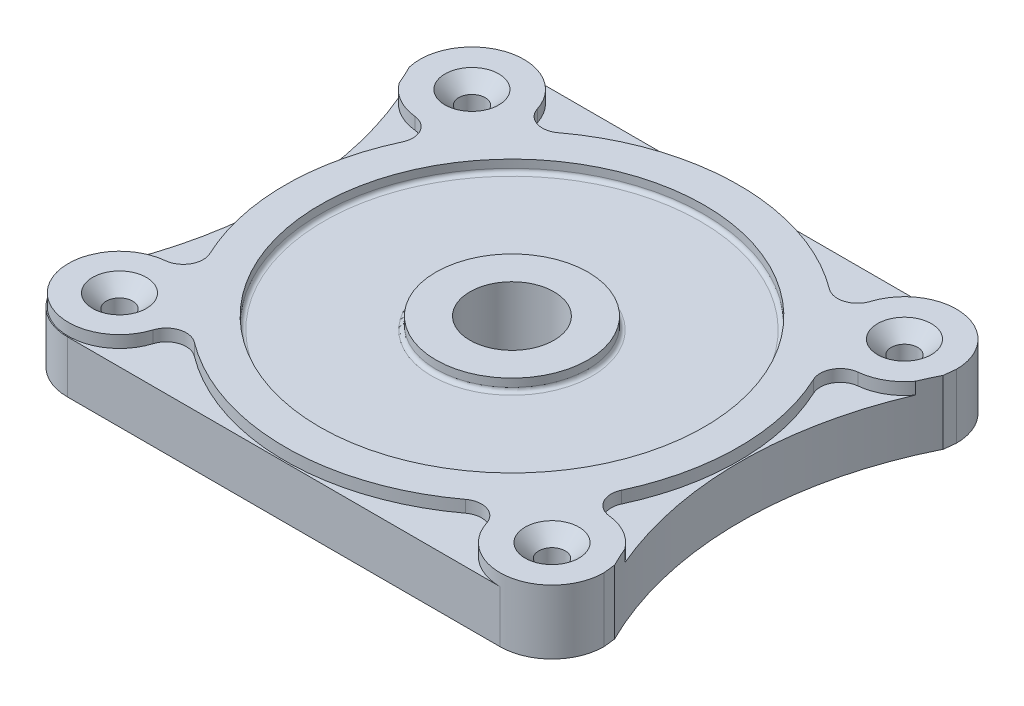
from build123d import *

# Parameters (mm, degrees)
SKETCH1_W                                            = 134
SKETCH1_H                                            = 114
BOSS_EXTRUDE1_DEPTH                                  = 16
SKETCH2_R                                            = 10.5
CUT_EXTRUDE1_DEPTH                                   = 90.409171789
SKETCH3_R                                            = 48
SKETCH3_R_2                                          = 19
CUT_EXTRUDE2_DEPTH                                   = 3
CUT_EXTRUDE3_START                                   = -3
SKETCH5_R                                            = 48
SKETCH5_R_2                                          = 19
CUT_EXTRUDE3_DEPTH                                   = 3
CSK_FOR_M6_HEX_SOCKET_COUNTERSUNK_CAP_SC_D           = 6.6
CSK_FOR_M6_HEX_SOCKET_COUNTERSUNK_CAP_SC_CSINK_D     = 13.44
CSK_FOR_M6_HEX_SOCKET_COUNTERSUNK_CAP_SC_CSINK_ANGLE = 90
SKETCH10_R                                           = 92
CUT_EXTRUDE4_DEPTH                                   = 90.409171789
CUT_EXTRUDE5_DEPTH                                   = 90.409171789
SKETCH13_OUTSIDE_W                                   = 171.332
SKETCH13_OUTSIDE_H                                   = 151.332
CUT_EXTRUDE6_DEPTH                                   = 3
CUT_EXTRUDE7_DEPTH                                   = 90.409171789
CUT_EXTRUDE9_DEPTH                                   = 89.921313531
CUT_EXTRUDE10_DEPTH                                  = 90.409171789
FILLET13_R                                           = 1
FILLET14_R                                           = 1
FILLET16_R                                           = 1
FILLET18_R                                           = 1


with BuildPart() as part:
    # Sketch1 → Boss-Extrude1 (new body)
    with BuildSketch(Plane(origin=(0, 0, 0), x_dir=(1, 0, 0), z_dir=(0, 1, 0))):
        Rectangle(SKETCH1_W, SKETCH1_H)
    extrude(amount=BOSS_EXTRUDE1_DEPTH)

    # Sketch2 → Cut-Extrude1 (cut, through all)
    with BuildSketch(Plane(origin=(0, 16, 0), x_dir=(1, 0, 0), z_dir=(0, 1, 0))):
        with Locations(Location((0, 0, 0), (0, 0, 270))):
            Circle(SKETCH2_R)
    extrude(amount=-CUT_EXTRUDE1_DEPTH, mode=Mode.SUBTRACT)

    # Sketch3 → Cut-Extrude2 (cut)
    with BuildSketch(Plane(origin=(0, 16, 0), x_dir=(1, 0, 0), z_dir=(0, 1, 0))):
        with Locations(Location((0, 0, 0), (0, 0, 270))):
            Circle(SKETCH3_R)
        with Locations(Location((0, 0, 0), (0, 0, 270))):
            Circle(SKETCH3_R_2, mode=Mode.SUBTRACT)
    extrude(amount=-CUT_EXTRUDE2_DEPTH, mode=Mode.SUBTRACT)

    # Sketch5 → Cut-Extrude3 (cut)
    with BuildSketch(Plane.XZ.offset(CUT_EXTRUDE3_START)):
        with Locations(Location((0, 0, 0), (0, 0, 90))):
            Circle(SKETCH5_R)
        with Locations(Location((0, 0, 0), (0, 0, 90))):
            Circle(SKETCH5_R_2, mode=Mode.SUBTRACT)
    extrude(amount=CUT_EXTRUDE3_DEPTH, mode=Mode.SUBTRACT)

    # CSK for M6 Hex Socket Countersunk Cap Screw1 (through all)
    with Locations(Plane(origin=(0, 16, 0), x_dir=(1, 0, 0), z_dir=(0, 1, 0))):
        with Locations((-54, 44), (54, 44), (54, -44), (-54, -44)):
            CounterSinkHole(CSK_FOR_M6_HEX_SOCKET_COUNTERSUNK_CAP_SC_D / 2, CSK_FOR_M6_HEX_SOCKET_COUNTERSUNK_CAP_SC_CSINK_D / 2, counter_sink_angle=CSK_FOR_M6_HEX_SOCKET_COUNTERSUNK_CAP_SC_CSINK_ANGLE)

    # Sketch10 → Cut-Extrude4 (cut, through all)
    with BuildSketch(Plane(origin=(0, 16, 0), x_dir=(1, 0, 0), z_dir=(0, 1, 0))):
        with Locations((149, 0)):
            Circle(SKETCH10_R)
        with Locations((-149, 0)):
            Circle(SKETCH10_R)
    extrude(amount=-CUT_EXTRUDE4_DEPTH, mode=Mode.SUBTRACT)

    # Sketch12 → Cut-Extrude5 (cut, through all)
    with BuildSketch(Plane(origin=(0, 16, 0), x_dir=(1, 0, 0), z_dir=(0, 1, 0))):
        with BuildLine():
            ThreePointArc((-54, -57), (-63.192388155, -53.192388155), (-67, -44))
            Line((-67, -44), (-67, -57))
            Line((-67, -57), (-54, -57))
        make_face()
        with BuildLine():
            ThreePointArc((67, -44), (63.192388155, -53.192388155), (54, -57))
            Line((54, -57), (67, -57))
            Line((67, -57), (67, -44))
        make_face()
        with BuildLine():
            Line((-67, 57), (-67, 44))
            ThreePointArc((-67, 44), (-63.192388155, 53.192388155), (-54, 57))
            Line((-54, 57), (-67, 57))
        make_face()
        with BuildLine():
            Line((67, 57), (54, 57))
            ThreePointArc((54, 57), (63.192388155, 53.192388155), (67, 44))
            Line((67, 44), (67, 57))
        make_face()
    extrude(amount=-CUT_EXTRUDE5_DEPTH, mode=Mode.SUBTRACT)

    # Sketch13 outside → Cut-Extrude6 (cut)
    with BuildSketch(Plane(origin=(0, 16, 0), x_dir=(1, 0, 0), z_dir=(0, 1, 0))):
        Rectangle(SKETCH13_OUTSIDE_W, SKETCH13_OUTSIDE_H)
        with BuildLine():
            ThreePointArc((-51.331145195, 23.980195102), (-56.656176853, -0.117680258), (-51.231084425, -24.193226589))
            ThreePointArc((-51.231084425, -24.193226589), (-51.401784959, -28.792660763), (-55.258927529, -31.303912362))
            ThreePointArc((-55.258927529, -31.303912362), (-63.890720648, -52.059105714), (-41.819855837, -47.797318529))
            ThreePointArc((-41.819855837, -47.797318529), (-38.581301156, -44.526890885), (-34.042183736, -45.288695617))
            ThreePointArc((-34.042183736, -45.288695617), (-0.117680258, -56.656176853), (33.853752972, -45.429721922))
            ThreePointArc((33.853752972, -45.429721922), (38.374825497, -44.679906606), (41.60767448, -47.928138008))
            ThreePointArc((41.60767448, -47.928138008), (64.078054812, -52.211748365), (55.344194725, -31.069681344))
            ThreePointArc((55.344194725, -31.069681344), (51.509943359, -28.559534684), (51.331145195, -23.980195102))
            ThreePointArc((51.331145195, -23.980195102), (56.656299069, 0), (51.331145195, 23.980195102))
            ThreePointArc((51.331145195, 23.980195102), (51.509943359, 28.559534684), (55.344194725, 31.069681344))
            ThreePointArc((55.344194725, 31.069681344), (64.078054812, 52.211748365), (41.60767448, 47.928138008))
            ThreePointArc((41.60767448, 47.928138008), (38.374825497, 44.679906606), (33.853752972, 45.429721922))
            ThreePointArc((33.853752972, 45.429721922), (0, 56.656299069), (-33.853752972, 45.429721922))
            ThreePointArc((-33.853752972, 45.429721922), (-38.374825497, 44.679906606), (-41.60767448, 47.928138008))
            ThreePointArc((-41.60767448, 47.928138008), (-64.078054812, 52.211748365), (-55.344194725, 31.069681344))
            ThreePointArc((-55.344194725, 31.069681344), (-51.509943359, 28.559534684), (-51.331145195, 23.980195102))
        make_face(mode=Mode.SUBTRACT)
    extrude(amount=-CUT_EXTRUDE6_DEPTH, mode=Mode.SUBTRACT)

    # Sketch14 → Cut-Extrude7 (cut, through all)
    with BuildSketch(Plane(origin=(0, 16, 0), x_dir=(1, 0, 0), z_dir=(0, 1, 0))):
        Polygon((67, 44), (66.656381451, 41.030823587), (67, 41.713307229), align=None)
    extrude(amount=-CUT_EXTRUDE7_DEPTH, mode=Mode.SUBTRACT)

    # Sketch15 → Cut-Extrude9 (cut, through all)
    with BuildSketch(Plane(origin=(0, 13, 0), x_dir=(1, 0, 0), z_dir=(0, 1, 0))):
        Polygon((67, -41.713307229), (66.656381451, -41.030823587), (67, -44), align=None)
    extrude(amount=-CUT_EXTRUDE9_DEPTH, mode=Mode.SUBTRACT)

    # Sketch16 → Cut-Extrude10 (cut, through all)
    with BuildSketch(Plane(origin=(0, 16, 0), x_dir=(1, 0, 0), z_dir=(0, 1, 0))):
        Polygon((66.656381451, -41.030823587), (67, -44), (67.112484147, -42.334698628), align=None)
    extrude(amount=-CUT_EXTRUDE10_DEPTH, mode=Mode.SUBTRACT)

    # Fillet13
    fillet13_edges = [part.edges().sort_by_distance(p)[0] for p in [
        (0, 13, -19),
    ]]
    fillet(fillet13_edges, radius=FILLET13_R)

    # Fillet14
    fillet14_edges = [part.edges().sort_by_distance(p)[0] for p in [
        (0, 13, -48),
    ]]
    fillet(fillet14_edges, radius=FILLET14_R)

    # Fillet16
    fillet16_edges = [part.edges().sort_by_distance(p)[0] for p in [
        (0, 3, -19),
    ]]
    fillet(fillet16_edges, radius=FILLET16_R)

    # Fillet18
    fillet18_edges = [part.edges().sort_by_distance(p)[0] for p in [
        (0, 3, -48),
    ]]
    fillet(fillet18_edges, radius=FILLET18_R)


solid = part.part
